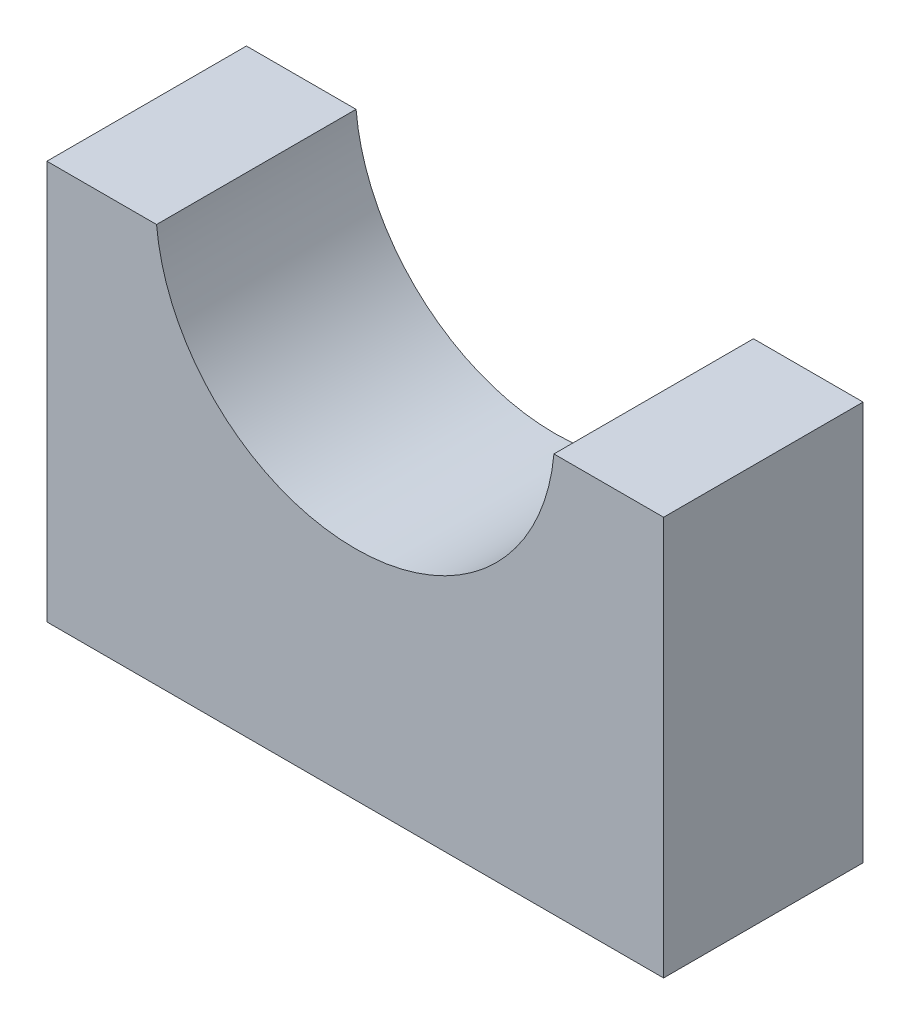
from build123d import *

# Parameters (mm, degrees)
BOSS_EXTRUDE1_DEPTH = 11


with BuildPart() as part:
    # Sketch1 → Boss-Extrude1 (new body)
    with BuildSketch(Plane.XY):
        with BuildLine():
            Line((-10.95445115, -1), (-17, -1))
            Line((-17, -1), (-17, -23))
            Line((-17, -23), (17, -23))
            Line((17, -23), (17, -1))
            Line((17, -1), (10.95445115, -1))
            ThreePointArc((10.95445115, -1), (0, -11), (-10.95445115, -1))
        make_face()
    extrude(amount=BOSS_EXTRUDE1_DEPTH)


solid = part.part
